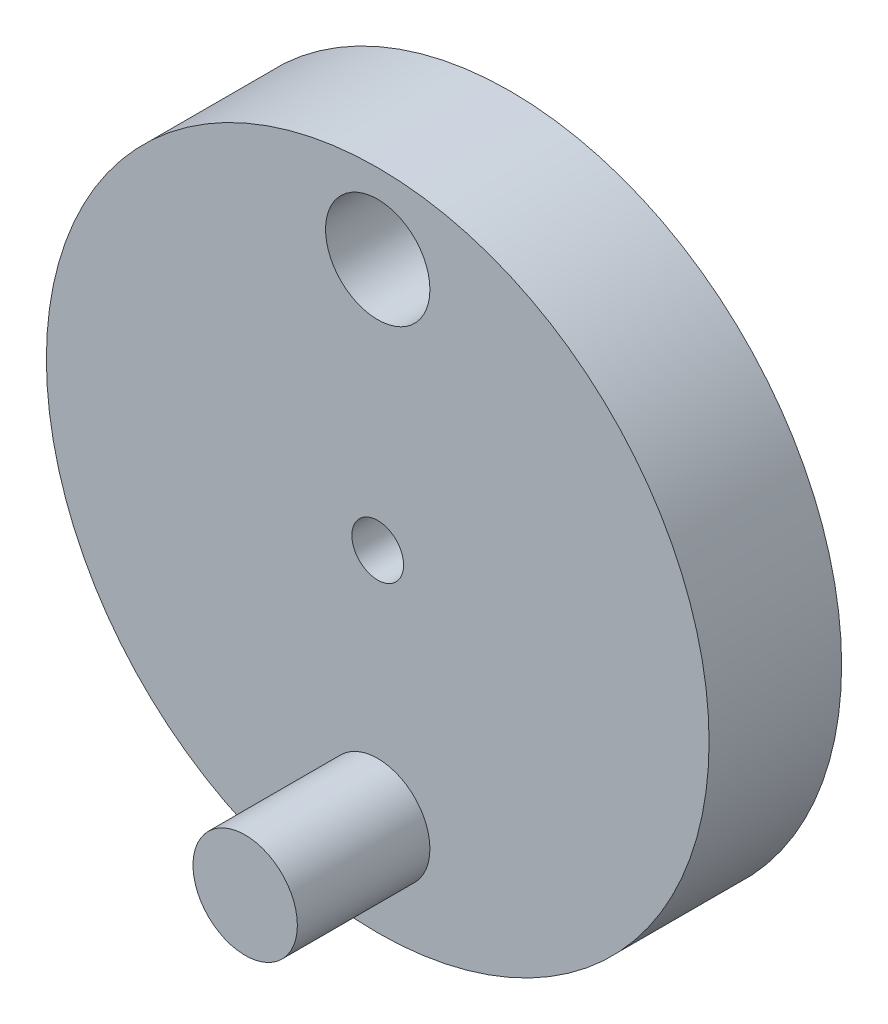
from build123d import *

# Parameters (mm, degrees)
SKETCH1_R           = 12.7
BOSS_EXTRUDE1_DEPTH = 5.08
SKETCH2_R           = 0.9906
CUT_EXTRUDE1_DEPTH  = 19.66511184
SKETCH3_R           = 2
CUT_EXTRUDE2_DEPTH  = 19.66511184
SKETCH4_R           = 2
BOSS_EXTRUDE2_DEPTH = 5.08


with BuildPart() as part:
    # Sketch1 → Boss-Extrude1 (new body)
    with BuildSketch(Plane.XY):
        Circle(SKETCH1_R)
    extrude(amount=BOSS_EXTRUDE1_DEPTH)

    # Sketch2 → Cut-Extrude1 (cut, through all)
    with BuildSketch(Plane.XY.offset(5.08)):
        Circle(SKETCH2_R)
    extrude(amount=-CUT_EXTRUDE1_DEPTH, mode=Mode.SUBTRACT)

    # Sketch3 → Cut-Extrude2 (cut, through all)
    with BuildSketch(Plane.XY.offset(5.08)):
        with Locations((0, 9.652)):
            Circle(SKETCH3_R)
    extrude(amount=-CUT_EXTRUDE2_DEPTH, mode=Mode.SUBTRACT)

    # Sketch4 → Boss-Extrude2 (add)
    with BuildSketch(Plane.XY.offset(5.08)):
        with Locations((0, -8.909221011)):
            Circle(SKETCH4_R)
    extrude(amount=BOSS_EXTRUDE2_DEPTH)


solid = part.part
